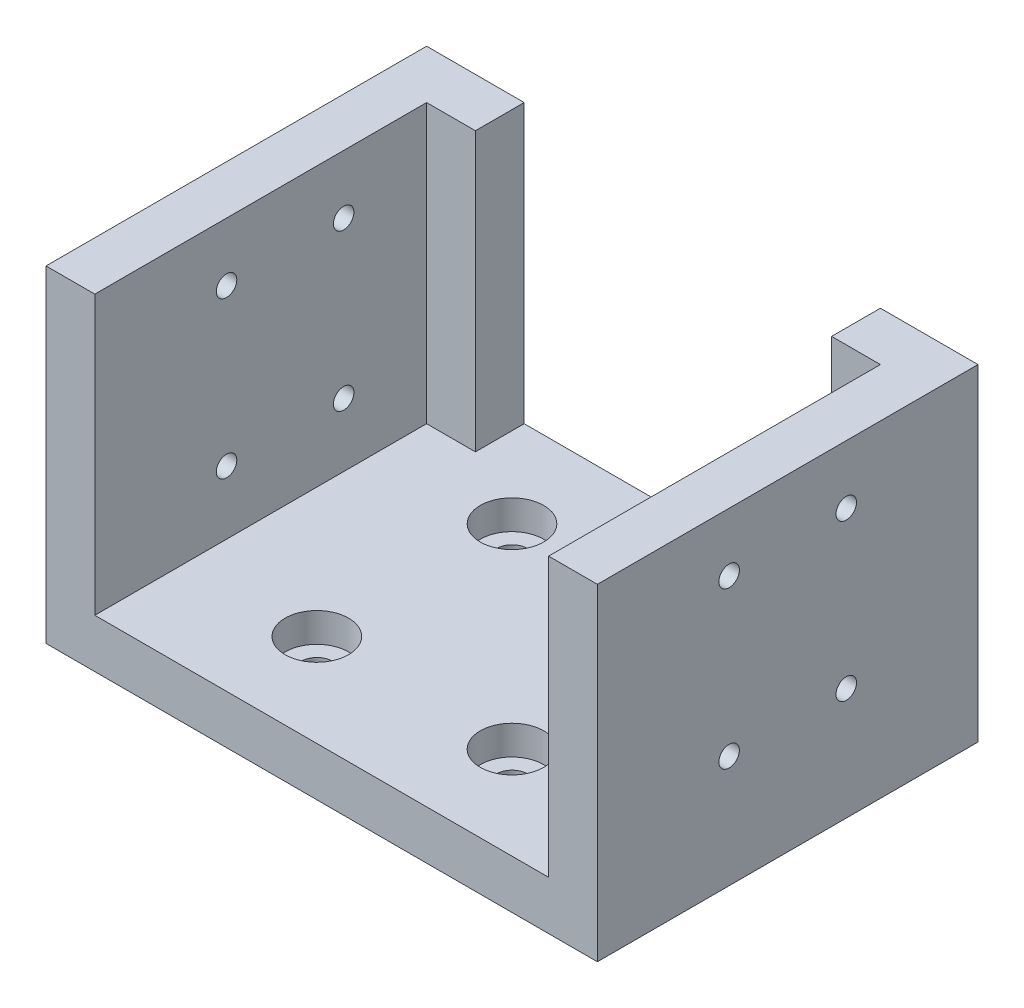
from build123d import *

# Parameters (mm, degrees)
SKETCH9_W                                       = 56.5
SKETCH9_H                                       = 39
BOSS_EXTRUDE7_DEPTH                             = 33.5
SKETCH10_R                                      = 1.05
CUT_EXTRUDE2_DEPTH                              = 69.518245745
CUT_EXTRUDE3_DEPTH                              = 28.5
SKETCH12_W                                      = 36.5
SKETCH12_H                                      = 28.5
CUT_EXTRUDE4_DEPTH                              = 56.464515683
CBORE_FOR_M3_SOCKET_HEAD_CAP_SCREW3_D           = 3.2
CBORE_FOR_M3_SOCKET_HEAD_CAP_SCREW3_CBORE_D     = 6.5
CBORE_FOR_M3_SOCKET_HEAD_CAP_SCREW3_CBORE_DEPTH = 3


with BuildPart() as part:
    # Sketch9 → Boss-Extrude7 (new body)
    with BuildSketch(Plane(origin=(0, 0, 0), x_dir=(1, 0, 0), z_dir=(0, 1, 0))):
        Rectangle(SKETCH9_W, SKETCH9_H)
    extrude(amount=BOSS_EXTRUDE7_DEPTH)

    # Sketch10 → Cut-Extrude2 (cut, through all)
    with BuildSketch(Plane(origin=(28.25, 0, 0), x_dir=(0, 0, -1), z_dir=(1, 0, 0))):
        with Locations((-6, 11.5)):
            Circle(SKETCH10_R)
        with Locations(Location((6, 11.5, 0), (0, 0, 180))):
            Circle(SKETCH10_R)
        with Locations((6, 27.5)):
            Circle(SKETCH10_R)
        with Locations(Location((-6, 27.5, 0), (0, 0, 180))):
            Circle(SKETCH10_R)
    extrude(amount=-CUT_EXTRUDE2_DEPTH, mode=Mode.SUBTRACT)

    # Sketch11 → Cut-Extrude3 (cut)
    with BuildSketch(Plane(origin=(0, 33.5, 0), x_dir=(1, 0, 0), z_dir=(0, 1, 0))):
        Polygon((-23.25, -14.5), (-23.25, -19.5), (23.25, -19.5), (23.25, -14.5), (23.25, 14.5), (-23.25, 14.5), align=None)
    extrude(amount=-CUT_EXTRUDE3_DEPTH, mode=Mode.SUBTRACT)

    # Sketch12 → Cut-Extrude4 (cut, through all)
    with BuildSketch(Plane.XY.offset(-14.5)):
        with Locations((0, 19.25)):
            Rectangle(SKETCH12_W, SKETCH12_H)
    extrude(amount=-CUT_EXTRUDE4_DEPTH, mode=Mode.SUBTRACT)

    # CBORE for M3 Socket Head Cap Screw3 (through all)
    with Locations(Plane(origin=(10, 5, -10), x_dir=(0, 0, 1), z_dir=(0, 1, 0))):
        with Locations((0, 0), (20, 0), (20, -20), (0, -20)):
            CounterBoreHole(CBORE_FOR_M3_SOCKET_HEAD_CAP_SCREW3_D / 2, CBORE_FOR_M3_SOCKET_HEAD_CAP_SCREW3_CBORE_D / 2, CBORE_FOR_M3_SOCKET_HEAD_CAP_SCREW3_CBORE_DEPTH)


solid = part.part
